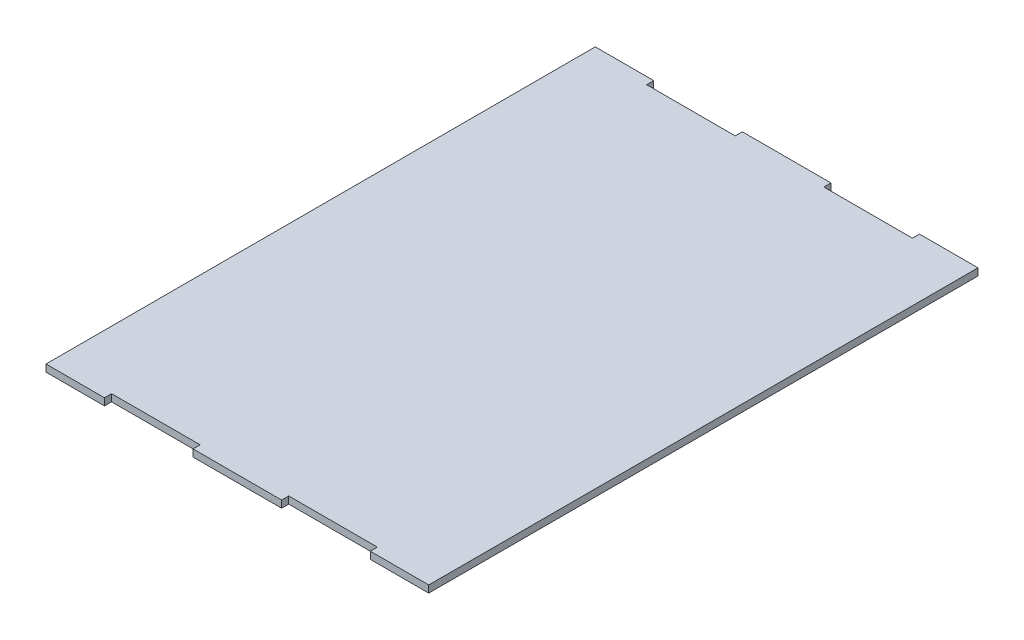
from build123d import *

# Parameters (mm, degrees)
CROQUIS1_W              = 216
CROQUIS1_H              = 310
SALIENTE_EXTRUIR1_DEPTH = 4
CROQUIS2_W              = 50
CROQUIS2_H              = 4
CORTAR_EXTRUIR1_DEPTH   = 4


with BuildPart() as part:
    # Croquis1 → Saliente-Extruir1 (new body)
    with BuildSketch(Plane(origin=(0, 0, 0), x_dir=(1, 0, 0), z_dir=(0, 1, 0))):
        Rectangle(CROQUIS1_W, CROQUIS1_H)
    extrude(amount=SALIENTE_EXTRUIR1_DEPTH)

    # Croquis2 → Cortar-Extruir1 (cut)
    with BuildSketch(Plane(origin=(0, 4, 0), x_dir=(1, 0, 0), z_dir=(0, 1, 0))):
        with Locations((-50, -153)):
            Rectangle(CROQUIS2_W, CROQUIS2_H)
        with Locations((50, -153)):
            Rectangle(CROQUIS2_W, CROQUIS2_H)
        with Locations((-50, 153)):
            Rectangle(CROQUIS2_W, CROQUIS2_H)
        with Locations((50, 153)):
            Rectangle(CROQUIS2_W, CROQUIS2_H)
    extrude(amount=-CORTAR_EXTRUIR1_DEPTH, mode=Mode.SUBTRACT)


solid = part.part
